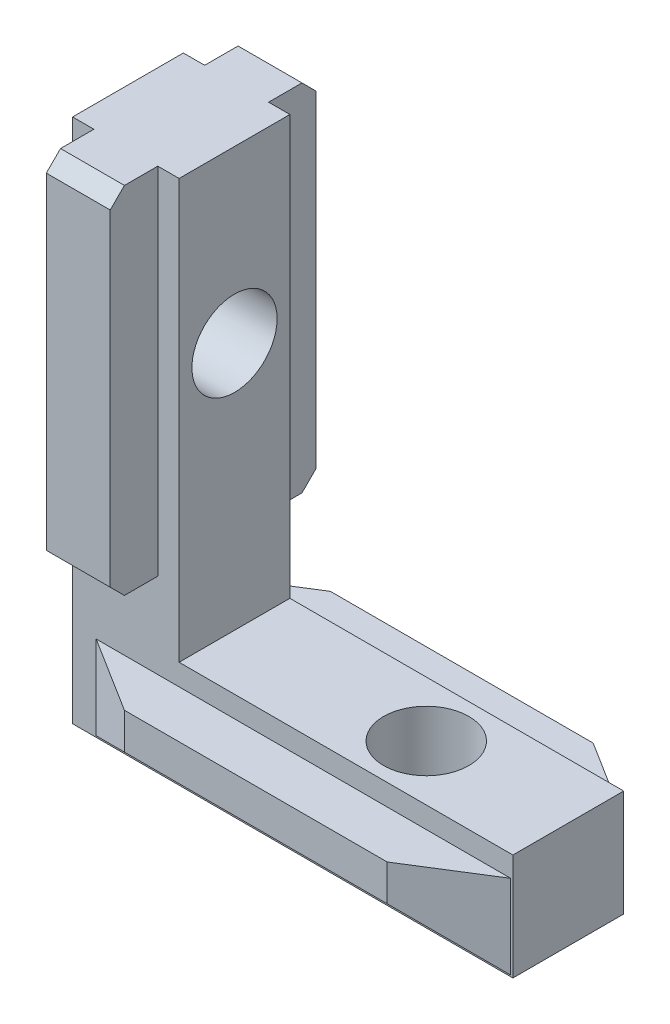
from build123d import *

# Parameters (mm, degrees)
SKETCH_1_W                = 31
SKETCH_1_H                = 37
EXTRUDE_1_DEPTH           = 7.8
SKETCH_2_W                = 23.5
SKETCH_2_H                = 29.5
CUT_EXTRUDE_1_DEPTH       = 49.896216623
SKETCH_3_W                = 29.18115942
SKETCH_3_H                = 5.9
EXTRUDE_2_DEPTH           = 3.35
SKETCH_4_W                = 4.5
SKETCH_4_H                = 25
EXTRUDE_3_DEPTH           = 3.35
SKETCH_5_W                = 4.5
SKETCH_5_H                = 25
EXTRUDE_4_DEPTH           = 3.35
SKETCH_6_W                = 29.18115942
SKETCH_6_H                = 5.9
EXTRUDE_5_DEPTH           = 3.35
DRAFT_1_ANGLE             = 45
DRAFT_2_ANGLE             = 45
DRAFT_3_ANGLE             = 57.901072745
DRAFT_4_ANGLE             = 57.901072745
HOLE_WIZARD_6_0_6_1_D     = 6
HOLE_WIZARD_6_0_6_2_D     = 6
HOLE_WIZARD_6_0_6_2_DEPTH = 37
CHAMFER_1_SIZE            = 1


with BuildPart() as part:
    # 草图1 → 凸台-拉伸1 (new body)
    with BuildSketch(Plane.XY.offset(3.9)):
        with Locations((15.5, 18.5)):
            Rectangle(SKETCH_1_W, SKETCH_1_H)
    extrude(amount=-EXTRUDE_1_DEPTH)

    # 草图2 → 切除-拉伸1 (cut, through all)
    with BuildSketch(Plane(origin=(0, 0, -3.9), x_dir=(-1, 0, 0), z_dir=(0, 0, -1))):
        with Locations((-19.25, 22.25)):
            Rectangle(SKETCH_2_W, SKETCH_2_H)
    extrude(amount=-CUT_EXTRUDE_1_DEPTH, mode=Mode.SUBTRACT)

    # 草图3 → 凸台-拉伸2 (add)
    with BuildSketch(Plane.XY.offset(3.9)):
        with Locations((16.25, 3.05)):
            Rectangle(SKETCH_3_W, SKETCH_3_H)
    extrude(amount=EXTRUDE_2_DEPTH)

    # 草图4 → 凸台-拉伸3 (add)
    with BuildSketch(Plane.XY.offset(3.9)):
        with Locations((3.75, 24.5)):
            Rectangle(SKETCH_4_W, SKETCH_4_H)
    extrude(amount=EXTRUDE_3_DEPTH)

    # 草图5 → 凸台-拉伸4 (add)
    with BuildSketch(Plane(origin=(0, 0, -3.9), x_dir=(-1, 0, 0), z_dir=(0, 0, -1))):
        with Locations((-3.75, 24.5)):
            Rectangle(SKETCH_5_W, SKETCH_5_H)
    extrude(amount=EXTRUDE_4_DEPTH)

    # 草图6 → 凸台-拉伸5 (add)
    with BuildSketch(Plane(origin=(0, 0, -3.9), x_dir=(-1, 0, 0), z_dir=(0, 0, -1))):
        with Locations((-16.25, 3.05)):
            Rectangle(SKETCH_6_W, SKETCH_6_H)
    extrude(amount=EXTRUDE_5_DEPTH)

    # 拔模1
    draft_1_faces = [part.faces().sort_by_distance(p)[0] for p in [
        (16.25, 0.1, -5.575),
    ]]
    draft(draft_1_faces, Plane(origin=(0, 0, -3.9), x_dir=(-1, 0, 0), z_dir=(0, 0, -1)), DRAFT_1_ANGLE)

    # 拔模2
    draft_2_faces = [part.faces().sort_by_distance(p)[0] for p in [
        (16.25, 0.1, 5.575),
    ]]
    draft(draft_2_faces, Plane.XY.offset(3.9), DRAFT_2_ANGLE)

    # 拔模3
    draft_3_faces = [part.faces().sort_by_distance(p)[0] for p in [
        (30.84057971, 3.776824458, -5.353648915),
        (1.65942029, 3.776824458, -5.353648915),
    ]]
    draft(draft_3_faces, Plane(origin=(0, 0, -3.9), x_dir=(-1, 0, 0), z_dir=(0, 0, -1)), DRAFT_3_ANGLE)

    # 拔模4
    draft_4_faces = [part.faces().sort_by_distance(p)[0] for p in [
        (30.84057971, 3.776824458, 5.353648915),
        (1.65942029, 3.776824458, 5.353648915),
    ]]
    draft(draft_4_faces, Plane.XY.offset(3.9), DRAFT_4_ANGLE)

    # Ø6.0 (6) 直径孔1 (through all)
    with Locations(Plane(origin=(7.5, 0, 0), x_dir=(0, 0, -1), z_dir=(1, 0, 0))):
        with Locations((0, 25)):
            Hole(HOLE_WIZARD_6_0_6_1_D / 2)

    # Ø6.0 (6) 直径孔2
    with Locations(Plane(origin=(0, 0, 0), x_dir=(-1, 0, 0), z_dir=(0, -1, 0))):
        with Locations((-21, 0)):
            Hole(HOLE_WIZARD_6_0_6_2_D / 2, depth=HOLE_WIZARD_6_0_6_2_DEPTH)

    # 倒角1
    chamfer_1_edges = [part.edges().sort_by_distance(p)[0] for p in [
        (3.75, 12, 7.25),
        (3.75, 37, 7.25),
        (3.75, 12, -7.25),
        (3.75, 37, -7.25),
    ]]
    chamfer(chamfer_1_edges, length=CHAMFER_1_SIZE)


solid = part.part
